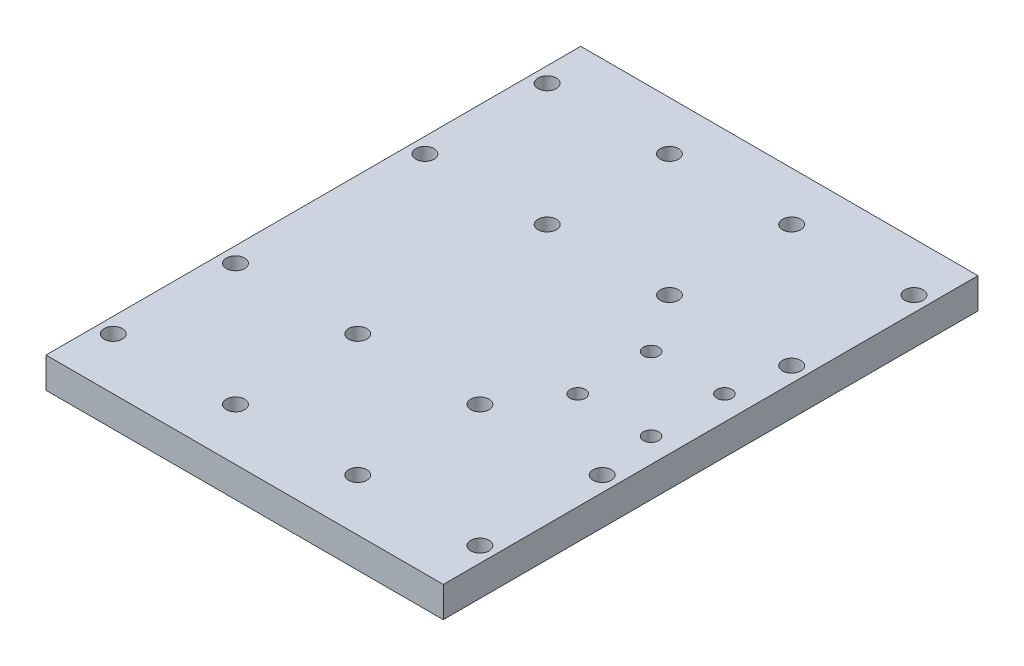
from build123d import *

# Parameters (mm, degrees)
SKETCH1_W           = 130
SKETCH1_H           = 156
SKETCH1_R           = 3
BOSS_EXTRUDE1_DEPTH = 10
SKETCH2_R           = 2.5
CUT_EXTRUDE1_DEPTH  = 10
SKETCH3_W           = 130
SKETCH3_H           = 10
BOSS_EXTRUDE2_DEPTH = 10
SKETCH4_W           = 130
SKETCH4_H           = 10
CUT_EXTRUDE2_DEPTH  = 10
SKETCH5_W           = 130
SKETCH5_H           = 10
BOSS_EXTRUDE3_DEPTH = 10
SKETCH6_W           = 130
SKETCH6_H           = 10
BOSS_EXTRUDE4_DEPTH = 8.98


with BuildPart() as part:
    # Sketch1 → Boss-Extrude1 (new body)
    with BuildSketch(Plane(origin=(0, 0, 0), x_dir=(1, 0, 0), z_dir=(0, 1, 0))):
        with Locations((65, -43.506875339)):
            Rectangle(SKETCH1_W, SKETCH1_H)
        with Locations(Location((5, 27.493124661, 0), (0, 0, 270))):
            Circle(SKETCH1_R, mode=Mode.SUBTRACT)
        with Locations(Location((45, 27.493124661, 0), (0, 0, 270))):
            Circle(SKETCH1_R, mode=Mode.SUBTRACT)
        with Locations(Location((45, -12.506875339, 0), (0, 0, 270))):
            Circle(SKETCH1_R, mode=Mode.SUBTRACT)
        with Locations(Location((5, -12.506875339, 0), (0, 0, 270))):
            Circle(SKETCH1_R, mode=Mode.SUBTRACT)
        with Locations(Location((85, 27.493124661, 0), (0, 0, 270))):
            Circle(SKETCH1_R, mode=Mode.SUBTRACT)
        with Locations(Location((125, 27.493124661, 0), (0, 0, 270))):
            Circle(SKETCH1_R, mode=Mode.SUBTRACT)
        with Locations(Location((85, -12.506875339, 0), (0, 0, 270))):
            Circle(SKETCH1_R, mode=Mode.SUBTRACT)
        with Locations(Location((125, -12.506875339, 0), (0, 0, 270))):
            Circle(SKETCH1_R, mode=Mode.SUBTRACT)
        with Locations(Location((85, -74.506875339, 0), (0, 0, 270))):
            Circle(SKETCH1_R, mode=Mode.SUBTRACT)
        with Locations(Location((125, -74.506875339, 0), (0, 0, 270))):
            Circle(SKETCH1_R, mode=Mode.SUBTRACT)
        with Locations(Location((125, -114.506875339, 0), (0, 0, 270))):
            Circle(SKETCH1_R, mode=Mode.SUBTRACT)
        with Locations(Location((85, -114.506875339, 0), (0, 0, 270))):
            Circle(SKETCH1_R, mode=Mode.SUBTRACT)
        with Locations(Location((5, -74.506875339, 0), (0, 0, 270))):
            Circle(SKETCH1_R, mode=Mode.SUBTRACT)
        with Locations(Location((45, -74.506875339, 0), (0, 0, 270))):
            Circle(SKETCH1_R, mode=Mode.SUBTRACT)
        with Locations(Location((5, -114.506875339, 0), (0, 0, 270))):
            Circle(SKETCH1_R, mode=Mode.SUBTRACT)
        with Locations(Location((45, -114.506875339, 0), (0, 0, 270))):
            Circle(SKETCH1_R, mode=Mode.SUBTRACT)
    extrude(amount=BOSS_EXTRUDE1_DEPTH)

    # Sketch2 → Cut-Extrude1 (cut)
    with BuildSketch(Plane(origin=(0, 10, 0), x_dir=(1, 0, 0), z_dir=(0, 1, 0))):
        with Locations(Location((98, -31.506875339, 0), (0, 0, 270))):
            Circle(SKETCH2_R)
        with Locations(Location((98, -55.506875339, 0), (0, 0, 270))):
            Circle(SKETCH2_R)
        with Locations(Location((122, -55.506875339, 0), (0, 0, 270))):
            Circle(SKETCH2_R)
        with Locations(Location((122, -31.506875339, 0), (0, 0, 270))):
            Circle(SKETCH2_R)
    extrude(amount=-CUT_EXTRUDE1_DEPTH, mode=Mode.SUBTRACT)

    # Sketch3 → Boss-Extrude2 (add)
    with BuildSketch(Plane(origin=(0, 0, -34.493124661), x_dir=(-1, 0, 0), z_dir=(0, 0, -1))):
        with Locations((-65, 5)):
            Rectangle(SKETCH3_W, SKETCH3_H)
    extrude(amount=BOSS_EXTRUDE2_DEPTH)

    # Sketch4 → Cut-Extrude2 (cut)
    with BuildSketch(Plane(origin=(0, 0, -44.493124661), x_dir=(-1, 0, 0), z_dir=(0, 0, -1))):
        with Locations((-65, 5)):
            Rectangle(SKETCH4_W, SKETCH4_H)
    extrude(amount=-CUT_EXTRUDE2_DEPTH, mode=Mode.SUBTRACT)

    # Sketch5 → Boss-Extrude3 (add)
    with BuildSketch(Plane.XY.offset(121.506875339)):
        with Locations((65, 5)):
            Rectangle(SKETCH5_W, SKETCH5_H)
    extrude(amount=BOSS_EXTRUDE3_DEPTH)

    # Sketch6 → Boss-Extrude4 (add)
    with BuildSketch(Plane(origin=(0, 0, -34.493124661), x_dir=(-1, 0, 0), z_dir=(0, 0, -1))):
        with Locations((-65, 5)):
            Rectangle(SKETCH6_W, SKETCH6_H)
    extrude(amount=BOSS_EXTRUDE4_DEPTH)


solid = part.part
